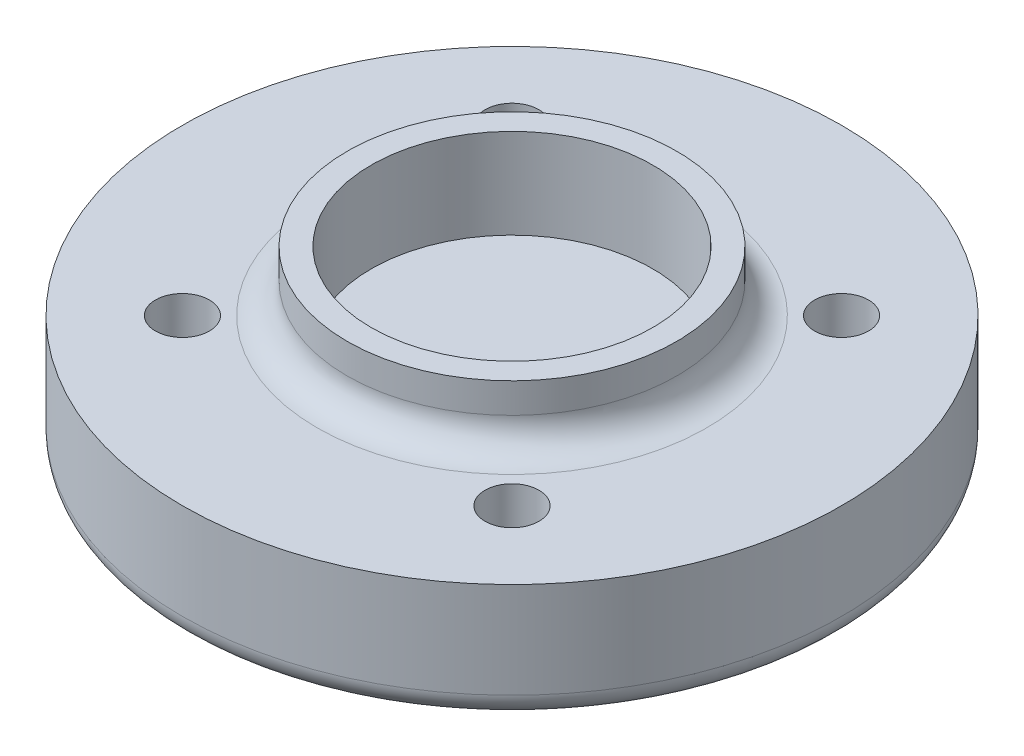
from build123d import *

# Parameters (mm, degrees)
SKETCH1_R                               = 55
BOSS_EXTRUDE1_DEPTH                     = 20
SKETCH2_R                               = 27.5
BOSS_EXTRUDE2_DEPTH                     = 10
SKETCH6_R                               = 23.5
CUT_EXTRUDE1_DEPTH                      = 15
FILLET1_R                               = 5
CBORE_FOR_M8_HEX_HEAD_BOLT1_D           = 9
CBORE_FOR_M8_HEX_HEAD_BOLT1_CBORE_D     = 18.011
CBORE_FOR_M8_HEX_HEAD_BOLT1_CBORE_DEPTH = 5.3
FILLET2_R                               = 4


with BuildPart() as part:
    # Sketch1 → Boss-Extrude1 (new body)
    with BuildSketch(Plane(origin=(0, 0, 0), x_dir=(1, 0, 0), z_dir=(0, 1, 0))):
        with Locations(Location((0, 0, 0), (0, 0, 270))):
            Circle(SKETCH1_R)
    extrude(amount=BOSS_EXTRUDE1_DEPTH)

    # Sketch2 → Boss-Extrude2 (add)
    with BuildSketch(Plane(origin=(0, 20, 0), x_dir=(1, 0, 0), z_dir=(0, 1, 0))):
        with Locations(Location((0, 0, 0), (0, 0, 270))):
            Circle(SKETCH2_R)
    extrude(amount=BOSS_EXTRUDE2_DEPTH)

    # Sketch6 → Cut-Extrude1 (cut)
    with BuildSketch(Plane(origin=(0, 30, 0), x_dir=(1, 0, 0), z_dir=(0, 1, 0))):
        with Locations(Location((0, 0, 0), (0, 0, 270))):
            Circle(SKETCH6_R)
    extrude(amount=-CUT_EXTRUDE1_DEPTH, mode=Mode.SUBTRACT)

    # Fillet1
    fillet1_edges = [part.edges().sort_by_distance(p)[0] for p in [
        (0, 20, -27.5),
    ]]
    fillet(fillet1_edges, radius=FILLET1_R)

    # CBORE for M8 Hex Head Bolt1 (through all)
    with Locations(Plane(origin=(27.5, 0, -27.5), x_dir=(0, 0, -1), z_dir=(0, -1, 0))):
        with Locations((0, 0), (0, -55), (-55, -55), (-55, 0)):
            CounterBoreHole(CBORE_FOR_M8_HEX_HEAD_BOLT1_D / 2, CBORE_FOR_M8_HEX_HEAD_BOLT1_CBORE_D / 2, CBORE_FOR_M8_HEX_HEAD_BOLT1_CBORE_DEPTH)

    # Fillet2
    fillet2_edges = [part.edges().sort_by_distance(p)[0] for p in [
        (0, 0, -55),
    ]]
    fillet(fillet2_edges, radius=FILLET2_R)


solid = part.part
